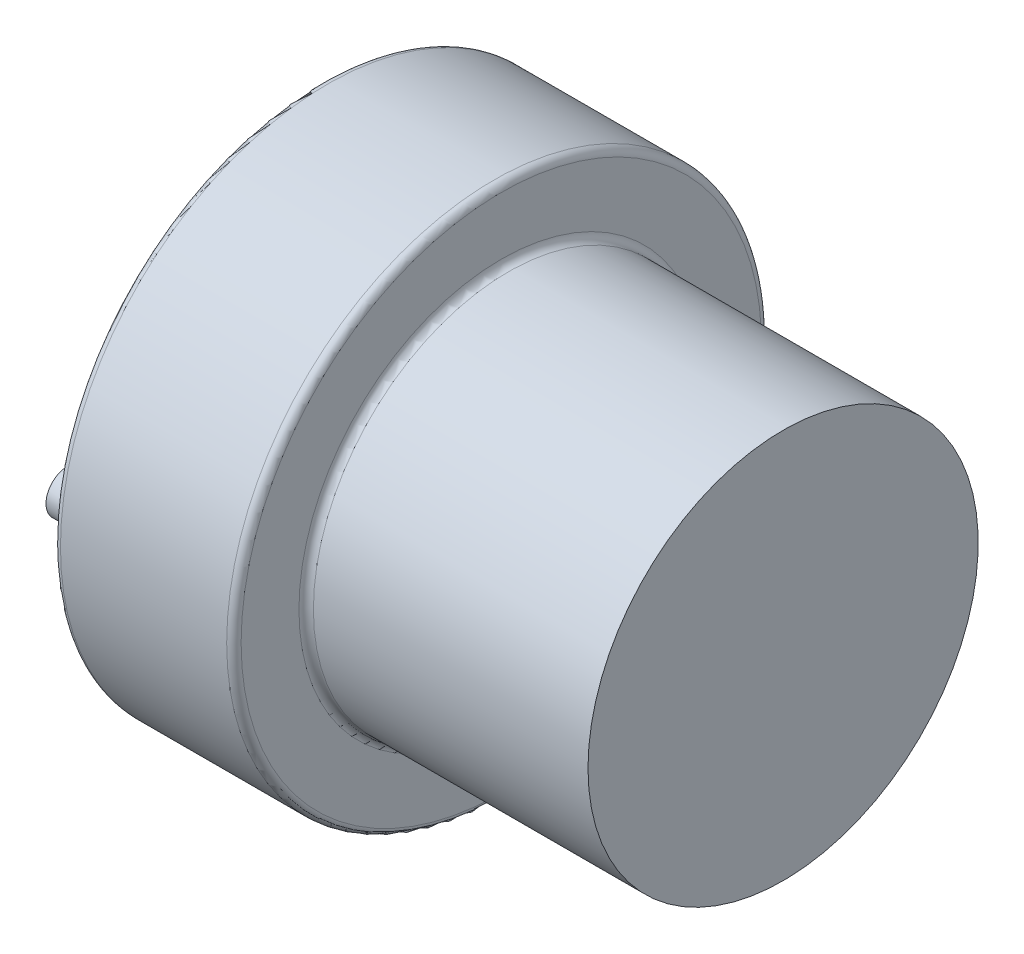
from build123d import *

# Parameters (mm, degrees)
SKETCH3_R           = 6
BOSS_EXTRUDE1_DEPTH = 10
FILLET1_R           = 1
FILLET2_R           = 1
SKETCH4_R           = 3
BOSS_EXTRUDE2_DEPTH = 25


with BuildPart() as part:
    # Sketch1 → Revolve1 (revolve)
    with BuildSketch(Plane.XY, mode=Mode.PRIVATE) as revolve1_sk:
        Polygon((86.321505474, 27), (47.321505474, 27), (47.321505474, 37), (22.321505474, 37), (22.321505474, 0), (86.321505474, 0), align=None)
    revolve(revolve1_sk.sketch.rotate(Axis((-66.563531294, 0, 0), (1, 0, 0)), 90), axis=Axis((-66.563531294, 0, 0), (1, 0, 0)))

    # Sketch3 → Boss-Extrude1 (add)
    with BuildSketch(Plane.ZY.offset(-22.321505474)):
        with Locations(Location((0, -29.8, 0), (0, 0, 180))):
            Circle(SKETCH3_R)
    extrude(amount=BOSS_EXTRUDE1_DEPTH)

    # Fillet1
    fillet1_edges = [part.edges().sort_by_distance(p)[0] for p in [
        (22.321505474, -29.8, 6),
        (12.321505474, -29.8, 6),
    ]]
    fillet(fillet1_edges, radius=FILLET1_R)

    # Fillet2
    fillet2_edges = [part.edges().sort_by_distance(p)[0] for p in [
        (47.321505474, 0, -37),
        (22.321505474, 0, -37),
        (47.321505474, 0, -27),
    ]]
    fillet(fillet2_edges, radius=FILLET2_R)

    # Sketch4 → Boss-Extrude2 (add)
    with BuildSketch(Plane.ZY.offset(-12.321505474)):
        with Locations((0, -29.8)):
            Circle(SKETCH4_R)
    extrude(amount=BOSS_EXTRUDE2_DEPTH)


solid = part.part
